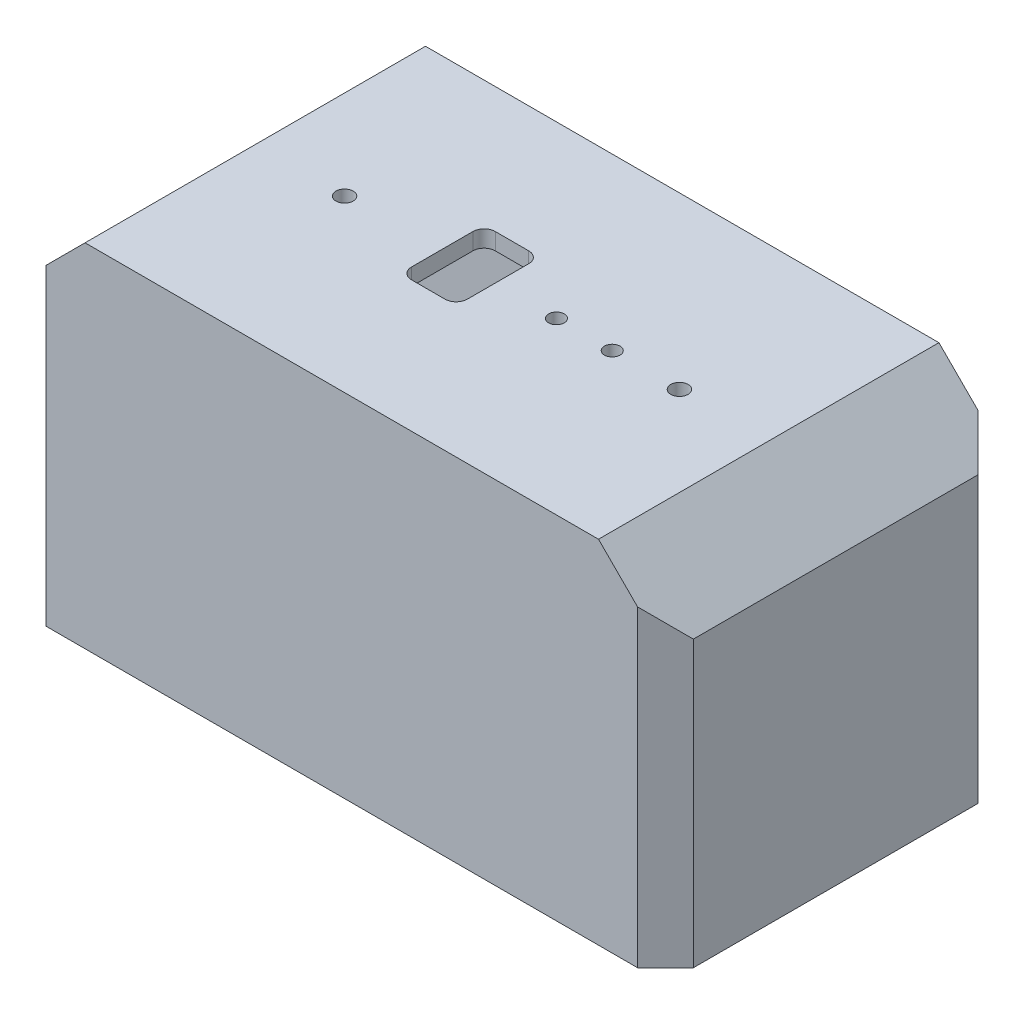
from build123d import *

# Parameters (mm, degrees)
SKETCH1_W           = 116
SKETCH1_H           = 61
SKETCH1_W_2         = 110
SKETCH1_H_2         = 55
BOSS_EXTRUDE1_DEPTH = 60
SKETCH2_W           = 116
SKETCH2_H           = 61
BOSS_EXTRUDE2_DEPTH = 3
CHAMFER1_SIZE       = 5
CHAMFER2_SIZE       = 6
SKETCH3_R           = 1.55
CUT_EXTRUDE1_DEPTH  = 3
SKETCH4_W           = 10
SKETCH4_H           = 15
CUT_EXTRUDE2_DEPTH  = 3
SKETCH5_R           = 1.4
CUT_EXTRUDE3_DEPTH  = 20
FILLET1_R           = 2
CHAMFER3_SIZE       = 12
CHAMFER4_SIZE       = 10
SKETCH6_W           = 58.5
SKETCH6_H           = 9.5
CUT_EXTRUDE4_DEPTH  = 10
SKETCH7_R           = 1.4
CUT_EXTRUDE5_DEPTH  = 10
SKETCH8_R           = 3
SKETCH8_R_2         = 1.4
BOSS_EXTRUDE3_DEPTH = 4


with BuildPart() as part:
    # Sketch1 → Boss-Extrude1 (new body)
    with BuildSketch(Plane(origin=(0, 0, 0), x_dir=(1, 0, 0), z_dir=(0, 1, 0))):
        Rectangle(SKETCH1_W, SKETCH1_H)
        Rectangle(SKETCH1_W_2, SKETCH1_H_2, mode=Mode.SUBTRACT)
    extrude(amount=BOSS_EXTRUDE1_DEPTH)

    # Sketch2 → Boss-Extrude2 (add)
    with BuildSketch(Plane(origin=(0, 60, 0), x_dir=(1, 0, 0), z_dir=(0, 1, 0))):
        Rectangle(SKETCH2_W, SKETCH2_H)
    extrude(amount=BOSS_EXTRUDE2_DEPTH)

    # Chamfer1
    chamfer1_edges = [part.edges().sort_by_distance(p)[0] for p in [
        (58, 31.5, 30.5),
        (-58, 31.5, 30.5),
        (-58, 31.5, -30.5),
        (58, 31.5, -30.5),
    ]]
    chamfer(chamfer1_edges, length=CHAMFER1_SIZE)

    # Chamfer2
    chamfer2_edges = [part.edges().sort_by_distance(p)[0] for p in [
        (55, 30, 27.5),
        (55, 30, -27.5),
        (-55, 30, -27.5),
        (-55, 30, 27.5),
    ]]
    chamfer(chamfer2_edges, length=CHAMFER2_SIZE)

    # Sketch3 → Cut-Extrude1 (cut)
    with BuildSketch(Plane(origin=(0, 63, 0), x_dir=(1, 0, 0), z_dir=(0, 1, 0))):
        with Locations(Location((30, 0, 0), (0, 0, 270))):
            Circle(SKETCH3_R)
        with Locations(Location((-30, 0, 0), (0, 0, 270))):
            Circle(SKETCH3_R)
    extrude(amount=-CUT_EXTRUDE1_DEPTH, mode=Mode.SUBTRACT)

    # Sketch4 → Cut-Extrude2 (cut)
    with BuildSketch(Plane(origin=(0, 63, 0), x_dir=(1, 0, 0), z_dir=(0, 1, 0))):
        with Locations((-8, 0.5)):
            Rectangle(SKETCH4_W, SKETCH4_H)
    extrude(amount=-CUT_EXTRUDE2_DEPTH, mode=Mode.SUBTRACT)

    # Sketch5 → Cut-Extrude3 (cut)
    with BuildSketch(Plane.XZ):
        with Locations(Location((53.7, -26.2, 0), (0, 0, 270))):
            Circle(SKETCH5_R)
        with Locations(Location((-53.7, -26.2, 0), (0, 0, 270))):
            Circle(SKETCH5_R)
        with Locations(Location((-53.7, 26.2, 0), (0, 0, 270))):
            Circle(SKETCH5_R)
        with Locations(Location((53.7, 26.2, 0), (0, 0, 270))):
            Circle(SKETCH5_R)
    extrude(amount=-CUT_EXTRUDE3_DEPTH, mode=Mode.SUBTRACT)

    # Fillet1
    fillet1_edges = [part.edges().sort_by_distance(p)[0] for p in [
        (-3, 61.5, -8),
        (-3, 61.5, 7),
        (-13, 61.5, 7),
        (-13, 61.5, -8),
    ]]
    fillet(fillet1_edges, radius=FILLET1_R)

    # Chamfer3
    chamfer3_edges = [part.edges().sort_by_distance(p)[0] for p in [
        (58, 63, 0),
        (-58, 63, 0),
    ]]
    chamfer(chamfer3_edges, length=CHAMFER3_SIZE)

    # Chamfer4
    chamfer4_edges = [part.edges().sort_by_distance(p)[0] for p in [
        (55, 60, 0),
        (-55, 60, 0),
    ]]
    chamfer(chamfer4_edges, length=CHAMFER4_SIZE)

    # Sketch6 → Cut-Extrude4 (cut)
    with BuildSketch(Plane(origin=(0, 0, -30.5), x_dir=(-1, 0, 0), z_dir=(0, 0, -1))):
        with Locations((0, 4.75)):
            Rectangle(SKETCH6_W, SKETCH6_H)
    extrude(amount=-CUT_EXTRUDE4_DEPTH, mode=Mode.SUBTRACT)

    # Sketch7 → Cut-Extrude5 (cut)
    with BuildSketch(Plane(origin=(0, 63, 0), x_dir=(1, 0, 0), z_dir=(0, 1, 0))):
        with Locations(Location((7.959772519, 0, 0), (0, 0, 270))):
            Circle(SKETCH7_R)
        with Locations(Location((17.959772519, 0, 0), (0, 0, 270))):
            Circle(SKETCH7_R)
    extrude(amount=-CUT_EXTRUDE5_DEPTH, mode=Mode.SUBTRACT)

    # Sketch8 → Boss-Extrude3 (add)
    # profile 1 of 2: a face of its own
    with BuildSketch(Plane.XZ.offset(-60)):
        with Locations(Location((7.959772519, 0, 0), (0, 0, 90))):
            Circle(SKETCH8_R)
        with Locations(Location((7.959772519, 0, 0), (0, 0, 90))):
            Circle(SKETCH8_R_2, mode=Mode.SUBTRACT)
    # profile 2 of 2: a face of its own
    with BuildSketch(Plane.XZ.offset(-60)):
        with Locations(Location((17.959772519, 0, 0), (0, 0, 90))):
            Circle(SKETCH8_R)
        with Locations(Location((17.959772519, 0, 0), (0, 0, 90))):
            Circle(SKETCH8_R_2, mode=Mode.SUBTRACT)
    extrude(amount=BOSS_EXTRUDE3_DEPTH)


solid = part.part
